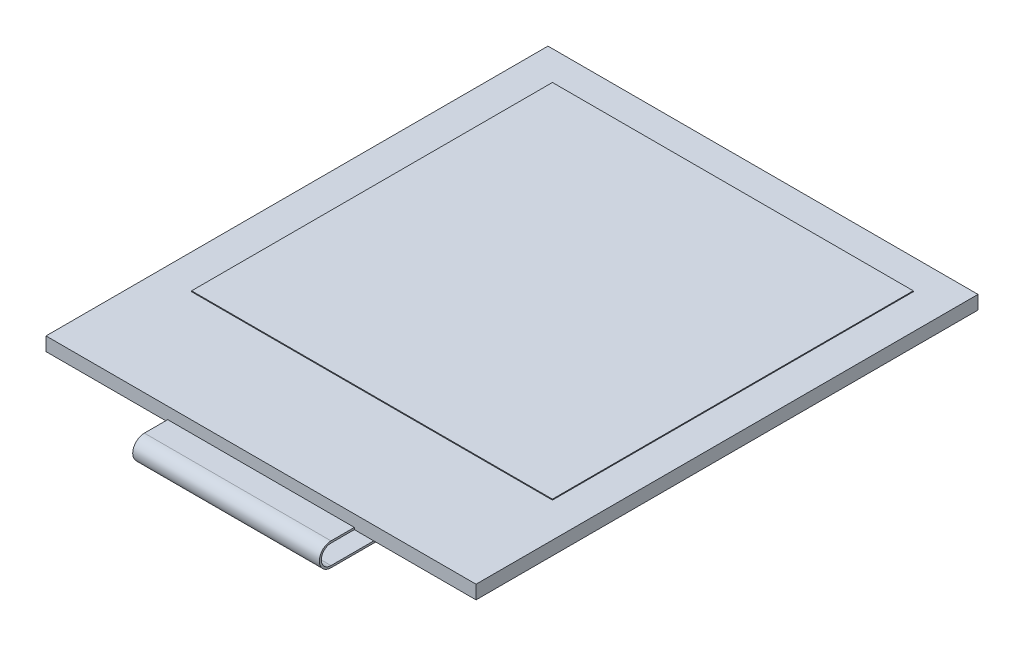
from build123d import *

# Parameters (mm, degrees)
SKETCH_1_W           = 22.12
SKETCH_1_H           = 25.82
SKETCH_1_W_2         = 18.56
SKETCH_1_H_2         = 18.56
EXTRUDE_1_DEPTH      = 0.7
SKETCH_1_2_W         = 18.56
SKETCH_1_2_H         = 18.56
EXTRUDE_2_DEPTH      = 0.745
EXTRUDE_3_DEPTH      = 4.8
EXTRUDE_3_DEPTH_BACK = 4.8
SKETCH_3_W           = 5.5
SKETCH_3_H           = 8
EXTRUDE_4_DEPTH      = 0.1
SKETCH_4_W           = 5.5
SKETCH_4_H           = 4.5
EXTRUDE_5_DEPTH      = 0.2


with BuildPart() as part:
    # 草图1 → 凸台-拉伸1 (new body)
    with BuildSketch(Plane(origin=(0, 0, 0), x_dir=(1, 0, 0), z_dir=(0, 1, 0))):
        with Locations((0, -2.08)):
            Rectangle(SKETCH_1_W, SKETCH_1_H)
        Rectangle(SKETCH_1_W_2, SKETCH_1_H_2, mode=Mode.SUBTRACT)
    extrude(amount=EXTRUDE_1_DEPTH)

    # 草图1<2> → 凸台-拉伸2 (add)
    with BuildSketch(Plane(origin=(0, 0, 0), x_dir=(1, 0, 0), z_dir=(0, 1, 0))):
        Rectangle(SKETCH_1_2_W, SKETCH_1_2_H)
    extrude(amount=EXTRUDE_2_DEPTH)

    # 草图2 → 凸台-拉伸3 (add, two sides: drawn at the far end of the back side and taken through both)
    with BuildSketch(Plane(origin=(0, 0, 0), x_dir=(0, 0, -1), z_dir=(1, 0, 0)).offset(-EXTRUDE_3_DEPTH_BACK)):
        with BuildLine():
            Line((-14.99, 0), (-16.19, 0))
            ThreePointArc((-16.19, 0), (-16.69, -0.5), (-16.19, -1))
            Line((-16.19, -1), (-12.76, -1))
            Line((-12.76, -1), (-12.76, -1.1))
            Line((-12.76, -1.1), (-16.19, -1.1))
            ThreePointArc((-16.19, -1.1), (-16.79, -0.5), (-16.19, 0.1))
            Line((-16.19, 0.1), (-14.99, 0.1))
            Line((-14.99, 0.1), (-14.99, 0))
        make_face()
    extrude(amount=EXTRUDE_3_DEPTH + EXTRUDE_3_DEPTH_BACK)

    # 草图3 → 凸台-拉伸4 (add)
    with BuildSketch(Plane.XZ.offset(1.1)):
        with Locations((0, 8.76)):
            Rectangle(SKETCH_3_W, SKETCH_3_H)
    extrude(amount=-EXTRUDE_4_DEPTH)

    # 草图4 → 凸台-拉伸5 (add)
    with BuildSketch(Plane.XZ.offset(1.1)):
        with Locations((0, 7.01)):
            Rectangle(SKETCH_4_W, SKETCH_4_H)
    extrude(amount=EXTRUDE_5_DEPTH)


solid = part.part
